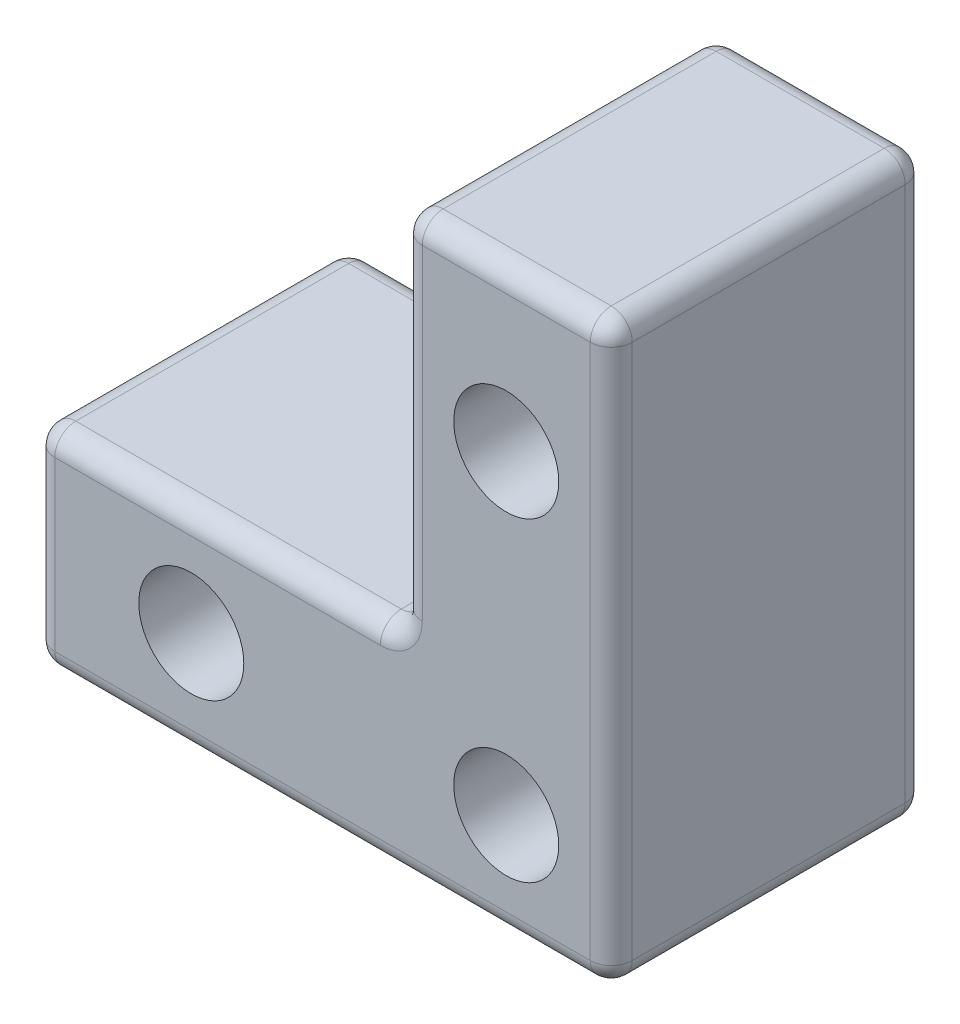
from build123d import *

# Parameters (mm, degrees)
SKETCH_1_W          = 60
SKETCH_1_H          = 20
SKETCH_1_W_2        = 30
SKETCH_1_H_2        = 35
EXTRUDE_1_DEPTH     = 30
SKETCH_2_R          = 5
CUT_EXTRUDE_1_DEPTH = 87.746757864
SKETCH_3_W          = 5
SKETCH_3_H          = 35
CUT_EXTRUDE_2_DEPTH = 87.746757864
FILLET_1_R          = 2


with BuildPart() as part:
    # 草图1 → 凸台-拉伸1 (new body)
    with BuildSketch(Plane.XY):
        with Locations((30, 10)):
            Rectangle(SKETCH_1_W, SKETCH_1_H)
        with Locations((45, 37.5)):
            Rectangle(SKETCH_1_W_2, SKETCH_1_H_2)
    extrude(amount=EXTRUDE_1_DEPTH)

    # 草图2 → 切除-拉伸1 (cut, through all)
    with BuildSketch(Plane.XY.offset(30)):
        with Locations((15, 10)):
            Circle(SKETCH_2_R)
        with Locations((45, 10)):
            Circle(SKETCH_2_R)
        with Locations((45, 40)):
            Circle(SKETCH_2_R)
    extrude(amount=-CUT_EXTRUDE_1_DEPTH, mode=Mode.SUBTRACT)

    # 草图3 → 切除-拉伸2 (cut, through all)
    with BuildSketch(Plane.XY.offset(30)):
        with Locations((32.5, 37.5)):
            Rectangle(SKETCH_3_W, SKETCH_3_H)
        Polygon((60, 20), (60, 55), (55, 55), (55, 20), (55, 0), (60, 0), align=None)
    extrude(amount=-CUT_EXTRUDE_2_DEPTH, mode=Mode.SUBTRACT)

    # 圆角1
    fillet_1_edges = [part.edges().sort_by_distance(p)[0] for p in [
        (27.5, 0, 0),
        (0, 0, 15),
        (0, 20, 15),
        (17.5, 20, 30),
        (0, 10, 30),
        (45, 55, 0),
        (45, 55, 30),
        (55, 27.5, 0),
        (55, 0, 15),
        (55, 55, 15),
        (55, 27.5, 30),
        (27.5, 0, 30),
        (35, 37.5, 0),
        (35, 55, 15),
        (35, 20, 15),
        (35, 37.5, 30),
        (0, 10, 0),
        (17.5, 20, 0),
    ]]
    fillet(fillet_1_edges, radius=FILLET_1_R)


solid = part.part
